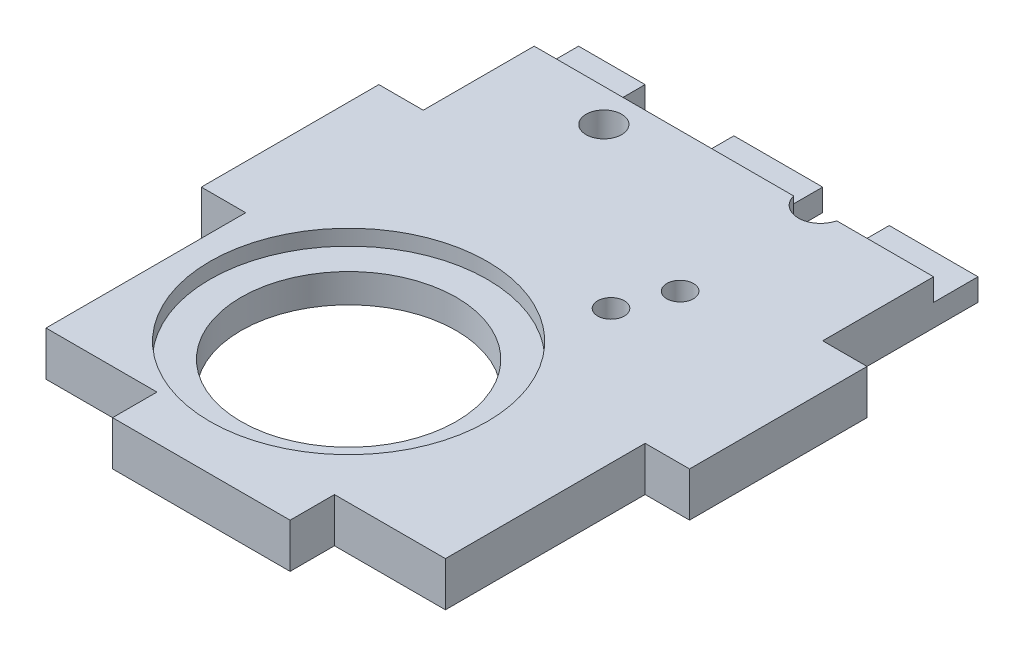
from build123d import *

# Parameters (mm, degrees)
SKETCH1_W           = 90
SKETCH1_H           = 110
SKETCH1_W_2         = 10
SKETCH1_H_2         = 40
SKETCH1_W_3         = 40
SKETCH1_H_3         = 10
BOSS_EXTRUDE1_DEPTH = 10
SKETCH2_R           = 4
CUT_EXTRUDE1_DEPTH  = 149.996644258
CUT_EXTRUDE2_DEPTH  = 149.996644258
SKETCH4_R           = 31.25
CUT_EXTRUDE3_DEPTH  = 3.5
SKETCH5_R           = 24.25
CUT_EXTRUDE4_DEPTH  = 149.802721749
SKETCH6_R           = 5
CUT_EXTRUDE5_DEPTH  = 149.996644258
SKETCH8_W           = 20
SKETCH8_H           = 5
SKETCH8_W_2         = 15
BOSS_EXTRUDE2_DEPTH = 10


with BuildPart() as part:
    # Sketch1 → Boss-Extrude1 (new body)
    with BuildSketch(Plane(origin=(0, 0, 0), x_dir=(1, 0, 0), z_dir=(0, 1, 0))):
        with Locations((45, 55)):
            Rectangle(SKETCH1_W, SKETCH1_H)
        with Locations((-5, 65)):
            Rectangle(SKETCH1_W_2, SKETCH1_H_2)
        with Locations((95, 65)):
            Rectangle(SKETCH1_W_2, SKETCH1_H_2)
        with Locations((45, -5)):
            Rectangle(SKETCH1_W_3, SKETCH1_H_3)
    extrude(amount=BOSS_EXTRUDE1_DEPTH)

    # Sketch2 → Cut-Extrude1 (cut, through all)
    with BuildSketch(Plane(origin=(0, 10, 0), x_dir=(1, 0, 0), z_dir=(0, 1, 0))):
        with Locations(Location((23.122776972, 102.57, 0), (0, 0, 270))):
            Circle(SKETCH2_R)
        with Locations((23.122776972, 120.41)):
            Circle(SKETCH2_R)
    extrude(amount=-CUT_EXTRUDE1_DEPTH, mode=Mode.SUBTRACT)

    # Sketch3 → Cut-Extrude2 (cut, through all)
    with BuildSketch(Plane(origin=(0, 10, 0), x_dir=(1, 0, 0), z_dir=(0, 1, 0))):
        with BuildLine():
            ThreePointArc((65.351977614, 81.42565129), (61.457970709, 79.741397678), (63.142224321, 75.847390774))
            Line((63.142224321, 75.847390774), (65.351977614, 81.42565129))
        make_face()
        with BuildLine():
            Line((65.351977614, 81.42565129), (63.142224321, 75.847390774))
            ThreePointArc((63.142224321, 75.847390774), (65.93312737, 76.155127276), (67.247100967, 78.636521032))
            ThreePointArc((67.247100967, 78.636521032), (66.728494723, 80.322547434), (65.351977614, 81.42565129))
        make_face()
        with BuildLine():
            ThreePointArc((58.722717735, 64.690869742), (61.513620784, 64.998606245), (62.827594381, 67.48))
            Line((62.827594381, 67.48), (59.827594381, 67.48))
            Line((59.827594381, 67.48), (58.722717735, 64.690869742))
        make_face()
        with BuildLine():
            Line((59.827594381, 67.48), (62.827594381, 67.48))
            ThreePointArc((62.827594381, 67.48), (62.308988137, 69.166026403), (60.932471028, 70.269130258))
            Line((60.932471028, 70.269130258), (59.827594381, 67.48))
        make_face()
        with BuildLine():
            Line((58.722717735, 64.690869742), (59.827594381, 67.48))
            Line((59.827594381, 67.48), (56.827594381, 67.48))
            ThreePointArc((56.827594381, 67.48), (57.346200626, 65.793973597), (58.722717735, 64.690869742))
        make_face()
        with BuildLine():
            Line((56.827594381, 67.48), (59.827594381, 67.48))
            Line((59.827594381, 67.48), (60.932471028, 70.269130258))
            ThreePointArc((60.932471028, 70.269130258), (58.141567979, 69.961393755), (56.827594381, 67.48))
        make_face()
    extrude(amount=-CUT_EXTRUDE2_DEPTH, mode=Mode.SUBTRACT)

    # Sketch4 → Cut-Extrude3 (cut)
    with BuildSketch(Plane(origin=(0, 10, 0), x_dir=(1, 0, 0), z_dir=(0, 1, 0))):
        with Locations(Location((36.72, 31.47, 0), (0, 0, 270))):
            Circle(SKETCH4_R)
    extrude(amount=-CUT_EXTRUDE3_DEPTH, mode=Mode.SUBTRACT)

    # Sketch5 → Cut-Extrude4 (cut, through all)
    with BuildSketch(Plane(origin=(0, 6.5, 0), x_dir=(1, 0, 0), z_dir=(0, 1, 0))):
        with Locations(Location((36.72, 31.47, 0), (0, 0, 270))):
            Circle(SKETCH5_R)
    extrude(amount=-CUT_EXTRUDE4_DEPTH, mode=Mode.SUBTRACT)

    # Sketch6 → Cut-Extrude5 (cut, through all)
    with BuildSketch(Plane(origin=(0, 10, 0), x_dir=(1, 0, 0), z_dir=(0, 1, 0))):
        with Locations((63.314917683, 111.209559188)):
            Circle(SKETCH6_R)
    extrude(amount=-CUT_EXTRUDE5_DEPTH, mode=Mode.SUBTRACT)

    # Sketch8 → Boss-Extrude2 (add)
    with BuildSketch(Plane(origin=(0, 0, -110), x_dir=(-1, 0, 0), z_dir=(0, 0, -1))):
        with Locations((-80, 2.5)):
            Rectangle(SKETCH8_W, SKETCH8_H)
        with Locations((-7.5, 2.5)):
            Rectangle(SKETCH8_W_2, SKETCH8_H)
        with Locations((-45, 2.5)):
            Rectangle(SKETCH8_W, SKETCH8_H)
    extrude(amount=BOSS_EXTRUDE2_DEPTH)


solid = part.part
